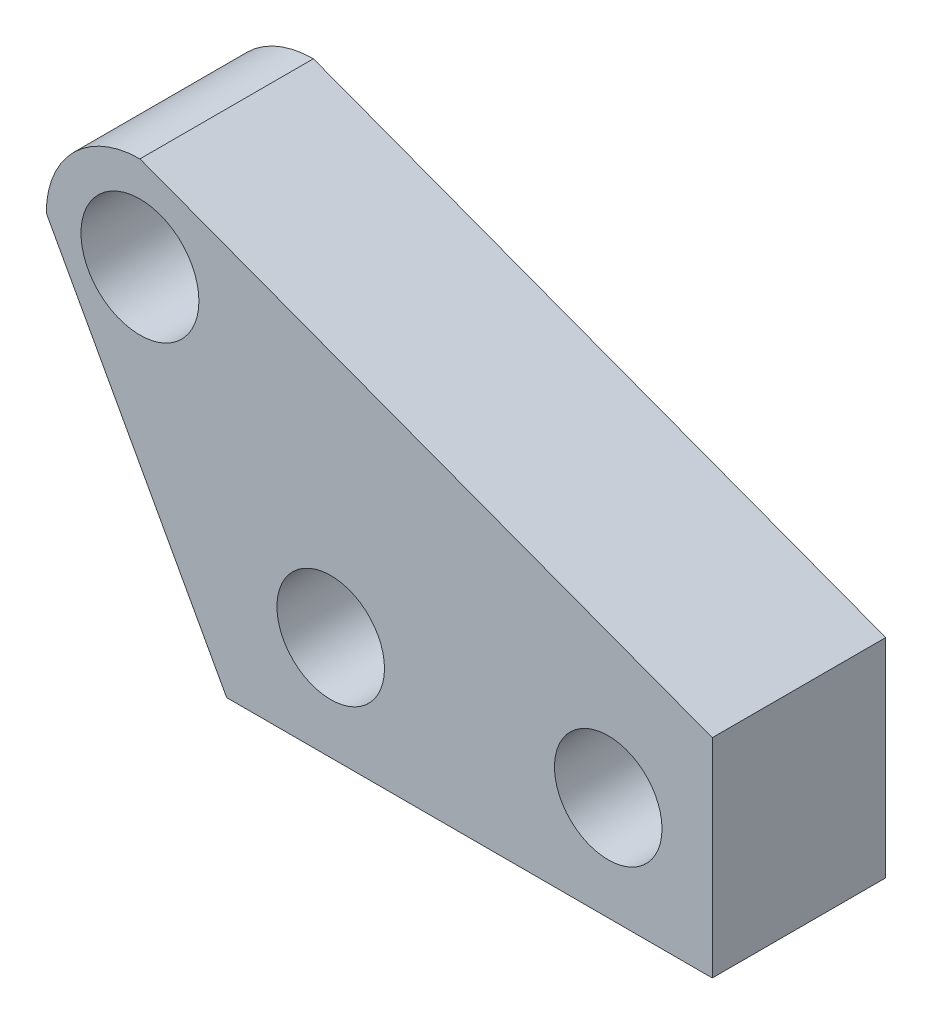
from build123d import *

# Parameters (mm, degrees)
SKETCH1_R           = 1.55
SKETCH1_R_2         = 1.7
BOSS_EXTRUDE1_DEPTH = 5


with BuildPart() as part:
    # Sketch1 → Boss-Extrude1 (new body)
    with BuildSketch(Plane.XY):
        with BuildLine():
            Line((-7, -3), (7, -3))
            Line((7, -3), (7, 3))
            Line((7, 3), (-9.5, 9.2))
            ThreePointArc((-9.5, 9.2), (-11.409188309, 8.409188309), (-12.2, 6.5))
            Line((-12.2, 6.5), (-7, -3))
        make_face()
        with Locations((4, 0)):
            Circle(SKETCH1_R, mode=Mode.SUBTRACT)
        with Locations((-4, 0)):
            Circle(SKETCH1_R, mode=Mode.SUBTRACT)
        with Locations((-9.5, 6.5)):
            Circle(SKETCH1_R_2, mode=Mode.SUBTRACT)
    extrude(amount=BOSS_EXTRUDE1_DEPTH)


solid = part.part
